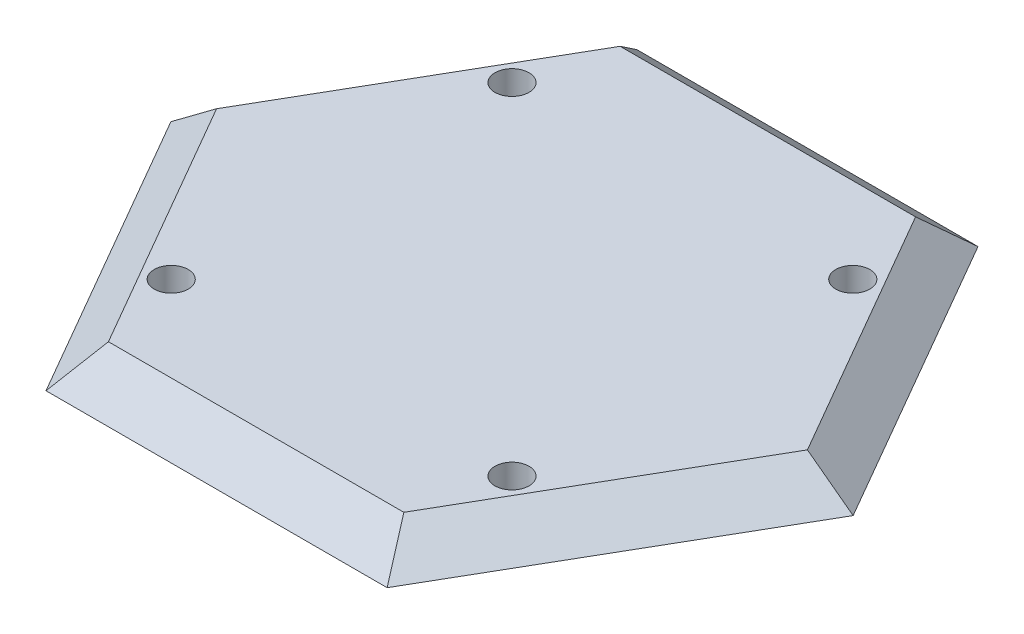
from build123d import *

# Parameters (mm, degrees)
SKETCH4_R          = 2.5
CUT_EXTRUDE1_DEPTH = 5
SKETCH5_R          = 2.5
CUT_EXTRUDE2_DEPTH = 5
SKETCH6_R          = 2.5
CUT_EXTRUDE3_DEPTH = 5
SKETCH7_R          = 2.5
CUT_EXTRUDE4_DEPTH = 5


with BuildPart() as part:
    # Sketch1 → Loft3 section 0
    with BuildSketch(Plane(origin=(0, 0, 0), x_dir=(1, 0, 0), z_dir=(0, 1, 0))):
        with BuildLine():
            Line((50.051560618, 0), (25.025780309, 43.345922995))
            Line((25.025780309, 43.345922995), (-25.025780309, 43.345922995))
            Line((-25.025780309, 43.345922995), (-50.051560618, 0))
            Line((-50.051560618, 0), (-25.025780309, -43.345922995))
            Line((-25.025780309, -43.345922995), (25.025780309, -43.345922995))
            Line((25.025780309, -43.345922995), (50.051560618, 0))
        make_face()
    # Sketch2 → Loft3 section 1
    with BuildSketch(Plane(origin=(0, 5, 0), x_dir=(1, 0, 0), z_dir=(0, 1, 0))):
        with BuildLine():
            Line((43.345922995, 0), (21.672961497, 37.538670464))
            Line((21.672961497, 37.538670464), (-21.672961497, 37.538670464))
            Line((-21.672961497, 37.538670464), (-43.345922995, 0))
            Line((-43.345922995, 0), (-21.672961497, -37.538670464))
            Line((-21.672961497, -37.538670464), (21.672961497, -37.538670464))
            Line((21.672961497, -37.538670464), (43.345922995, 0))
        make_face()
    loft()

    # Sketch4 → Cut-Extrude1 (cut)
    with BuildSketch(Plane(origin=(0, 5, 0), x_dir=(1, 0, 0), z_dir=(0, 1, 0))):
        with Locations(Location((-25, 25, 0), (0, 0, 270))):
            Circle(SKETCH4_R)
    extrude(amount=-CUT_EXTRUDE1_DEPTH, mode=Mode.SUBTRACT)

    # Sketch5 → Cut-Extrude2 (cut)
    with BuildSketch(Plane(origin=(0, 5, 0), x_dir=(1, 0, 0), z_dir=(0, 1, 0))):
        with Locations(Location((25, 25, 0), (0, 0, 270))):
            Circle(SKETCH5_R)
    extrude(amount=-CUT_EXTRUDE2_DEPTH, mode=Mode.SUBTRACT)

    # Sketch6 → Cut-Extrude3 (cut)
    with BuildSketch(Plane(origin=(0, 5, 0), x_dir=(1, 0, 0), z_dir=(0, 1, 0))):
        with Locations(Location((-25, -25, 0), (0, 0, 270))):
            Circle(SKETCH6_R)
    extrude(amount=-CUT_EXTRUDE3_DEPTH, mode=Mode.SUBTRACT)

    # Sketch7 → Cut-Extrude4 (cut)
    with BuildSketch(Plane(origin=(0, 5, 0), x_dir=(1, 0, 0), z_dir=(0, 1, 0))):
        with Locations(Location((25, -25, 0), (0, 0, 270))):
            Circle(SKETCH7_R)
    extrude(amount=-CUT_EXTRUDE4_DEPTH, mode=Mode.SUBTRACT)


solid = part.part
